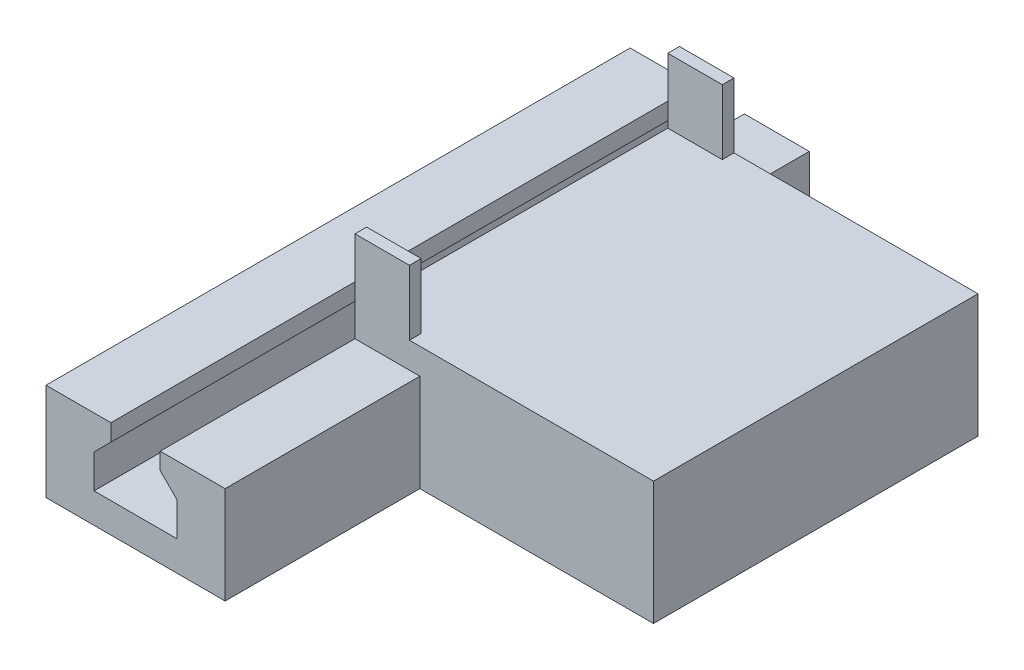
from build123d import *

# Parameters (mm, degrees)
BOSS_EXTRU_1_DEPTH = 45
ESQUISSE6_W        = 25
ESQUISSE6_H        = 7.5
BOSS_EXTRU_6_DEPTH = 18
ESQUISSE7_W        = 23
ESQUISSE7_H        = 25
BOSS_EXTRU_7_DEPTH = 2
ESQUISSE8_W        = 4.2
ESQUISSE8_H        = 0.9
BOSS_EXTRU_8_DEPTH = 5


with BuildPart() as part:
    # Esquisse1 → Boss.-Extru.1 (new body)
    with BuildSketch(Plane.XY):
        Polygon((-3.2, 0), (3.2, 0), (3.2, 2.6), (1.9, 3.9), (1.9, 5.2), (6.9, 5.2), (6.9, -2.3), (-6.9, -2.3), (-6.9, 5.2), (-1.9, 5.2), (-1.9, 3.9), (-3.2, 2.6), align=None)
    extrude(amount=BOSS_EXTRU_1_DEPTH)

    # Esquisse6 → Boss.-Extru.6 (add)
    with BuildSketch(Plane(origin=(6.9, 0, 0), x_dir=(0, 0, -1), z_dir=(1, 0, 0))):
        with Locations((-17.5, 1.45)):
            Rectangle(ESQUISSE6_W, ESQUISSE6_H)
    extrude(amount=BOSS_EXTRU_6_DEPTH)

    # Esquisse7 → Boss.-Extru.7 (add)
    with BuildSketch(Plane(origin=(0, 5.2, 0), x_dir=(1, 0, 0), z_dir=(0, 1, 0))):
        with Locations((13.4, -17.5)):
            Rectangle(ESQUISSE7_W, ESQUISSE7_H)
    extrude(amount=BOSS_EXTRU_7_DEPTH)

    # Esquisse8 → Boss.-Extru.8 (add)
    with BuildSketch(Plane(origin=(0, 7.2, 0), x_dir=(1, 0, 0), z_dir=(0, 1, 0))):
        with Locations((4, -29.55)):
            Rectangle(ESQUISSE8_W, ESQUISSE8_H)
        with Locations((4, -5.45)):
            Rectangle(ESQUISSE8_W, ESQUISSE8_H)
    extrude(amount=BOSS_EXTRU_8_DEPTH)


solid = part.part
